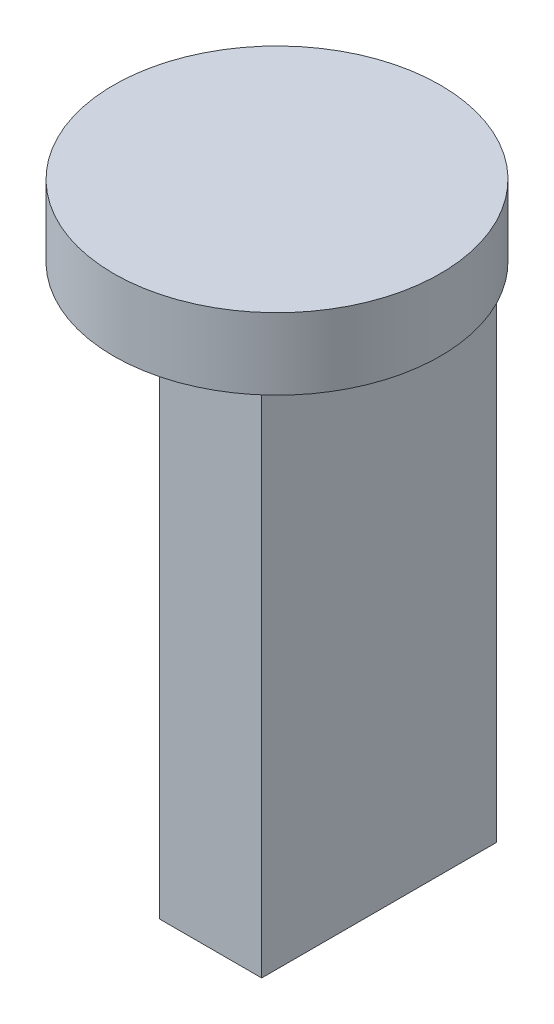
from build123d import *

# Parameters (mm, degrees)
CROQUIS1_W              = 15
CROQUIS1_H              = 50
CROQUIS1_W_2            = 50
CROQUIS1_H_2            = 115
SALIENTE_EXTRUIR1_DEPTH = 250
CROQUIS2_R              = 80
SALIENTE_EXTRUIR2_DEPTH = 35


with BuildPart() as part:
    # Croquis1 → Saliente-Extruir1 (new body)
    with BuildSketch(Plane(origin=(0, 0, 0), x_dir=(1, 0, 0), z_dir=(0, 1, 0))):
        with Locations((-32.5, 0)):
            Rectangle(CROQUIS1_W, CROQUIS1_H)
        Rectangle(CROQUIS1_W_2, CROQUIS1_H_2)
    extrude(amount=SALIENTE_EXTRUIR1_DEPTH)

    # Croquis2 → Saliente-Extruir2 (add)
    with BuildSketch(Plane(origin=(0, 250, 0), x_dir=(1, 0, 0), z_dir=(0, 1, 0))):
        with Locations(Location((-25, 0, 0), (0, 0, 270))):
            Circle(CROQUIS2_R)
    extrude(amount=SALIENTE_EXTRUIR2_DEPTH)


solid = part.part
